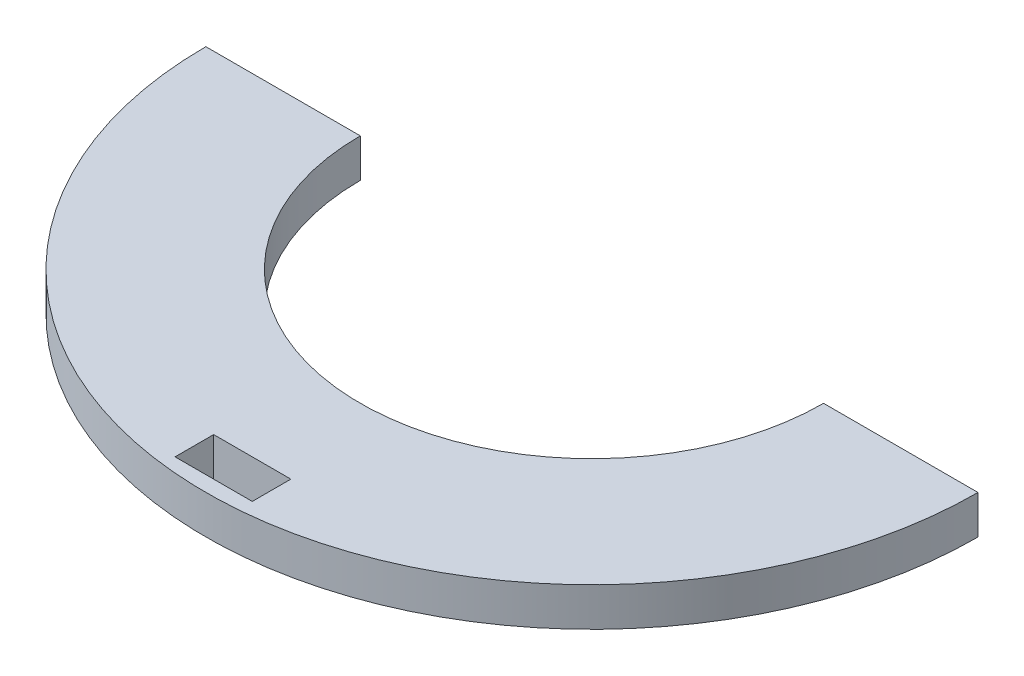
from build123d import *

# Parameters (mm, degrees)
BOSS_EXTRUDE1_DEPTH = 5
SKETCH2_W           = 10
SKETCH2_H           = 5
CUT_EXTRUDE2_DEPTH  = 10


with BuildPart() as part:
    # Sketch1 → Boss-Extrude1 (new body)
    with BuildSketch(Plane(origin=(0, 0, 0), x_dir=(1, 0, 0), z_dir=(0, 1, 0))):
        with BuildLine():
            Line((-30, 0), (-50, 0))
            ThreePointArc((-50, 0), (0, -50), (50, 0))
            Line((50, 0), (30, 0))
            ThreePointArc((30, 0), (0, -30), (-30, 0))
        make_face()
    extrude(amount=BOSS_EXTRUDE1_DEPTH)

    # Sketch2 → Cut-Extrude2 (cut)
    with BuildSketch(Plane(origin=(0, 5, 0), x_dir=(1, 0, 0), z_dir=(0, 1, 0))):
        with Locations((-0.99008289, -45.5)):
            Rectangle(SKETCH2_W, SKETCH2_H)
    extrude(amount=-CUT_EXTRUDE2_DEPTH, mode=Mode.SUBTRACT)


solid = part.part
